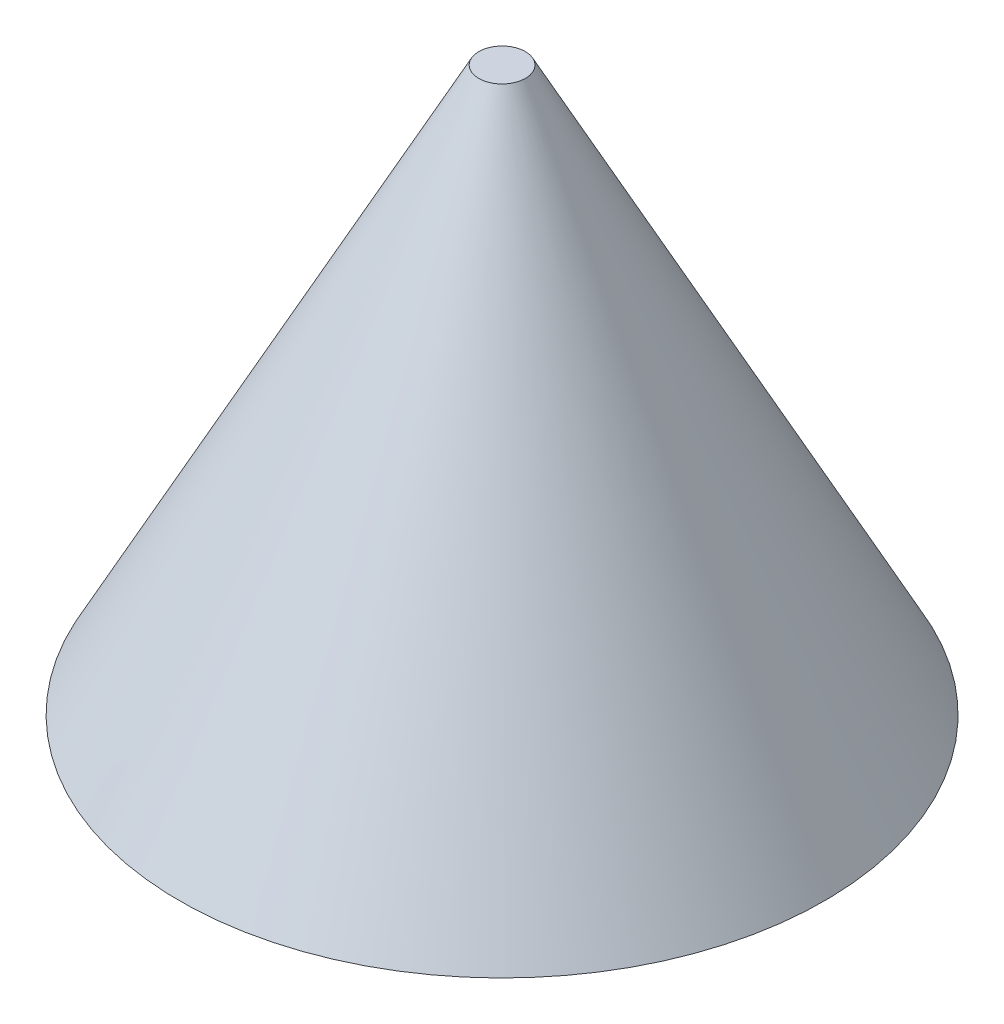
from build123d import *


with BuildPart() as part:
    # Esquisse1 → Révolution1 (revolve)
    with BuildSketch(Plane.XY, mode=Mode.PRIVATE) as r_volution1_sk:
        Polygon((21, 0), (21, 41.615793699), (0, 81.111049471), (0, 83.989087948), (3, 83.989087948), (41.562177141, 11.464180838), (37.031896938, 11.464180838), (32.493321383, 20), (25, 20), (25, 0), align=None)
    revolve(r_volution1_sk.sketch.rotate(Axis((0, 0, 0), (0, 1, 0)), 90), axis=Axis((0, 0, 0), (0, 1, 0)))


solid = part.part
